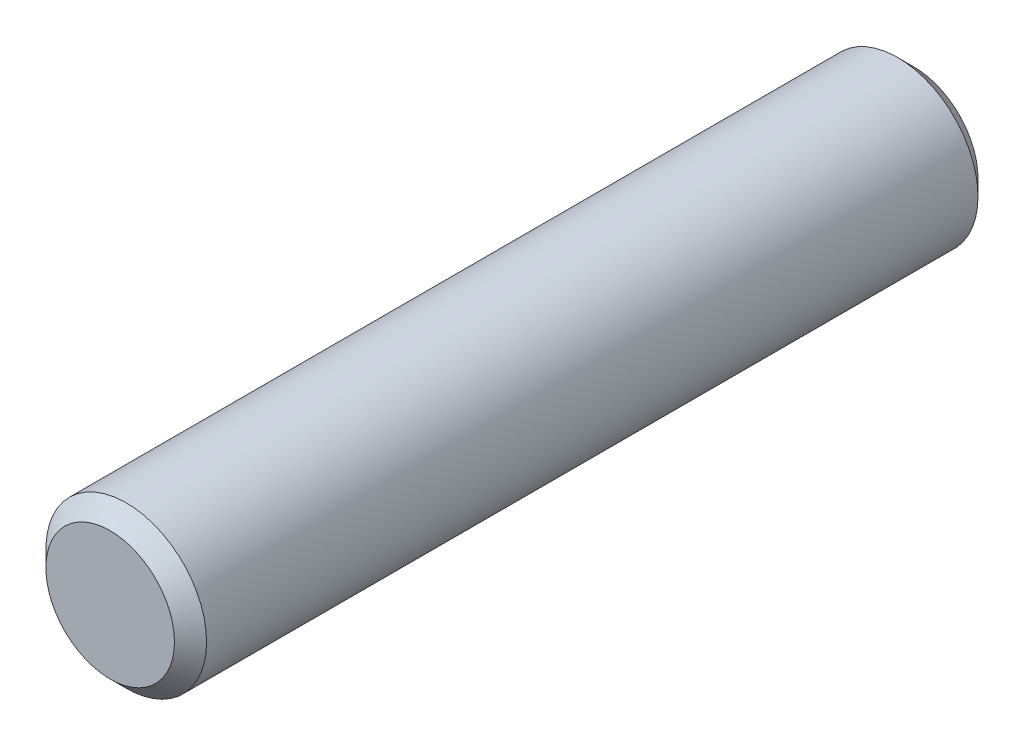
from build123d import *

# Parameters (mm, degrees)
SKETCH1_R           = 6.35
BOSS_EXTRUDE1_DEPTH = 63.5
CHAMFER1_SIZE       = 1.27


with BuildPart() as part:
    # Sketch1 → Boss-Extrude1 (new body)
    with BuildSketch(Plane.XY):
        Circle(SKETCH1_R)
    extrude(amount=-BOSS_EXTRUDE1_DEPTH)

    # Chamfer1
    chamfer1_edges = [part.edges().sort_by_distance(p)[0] for p in [
        (-6.35, 0, 0),
        (-6.35, 0, -63.5),
    ]]
    chamfer(chamfer1_edges, length=CHAMFER1_SIZE)


solid = part.part
